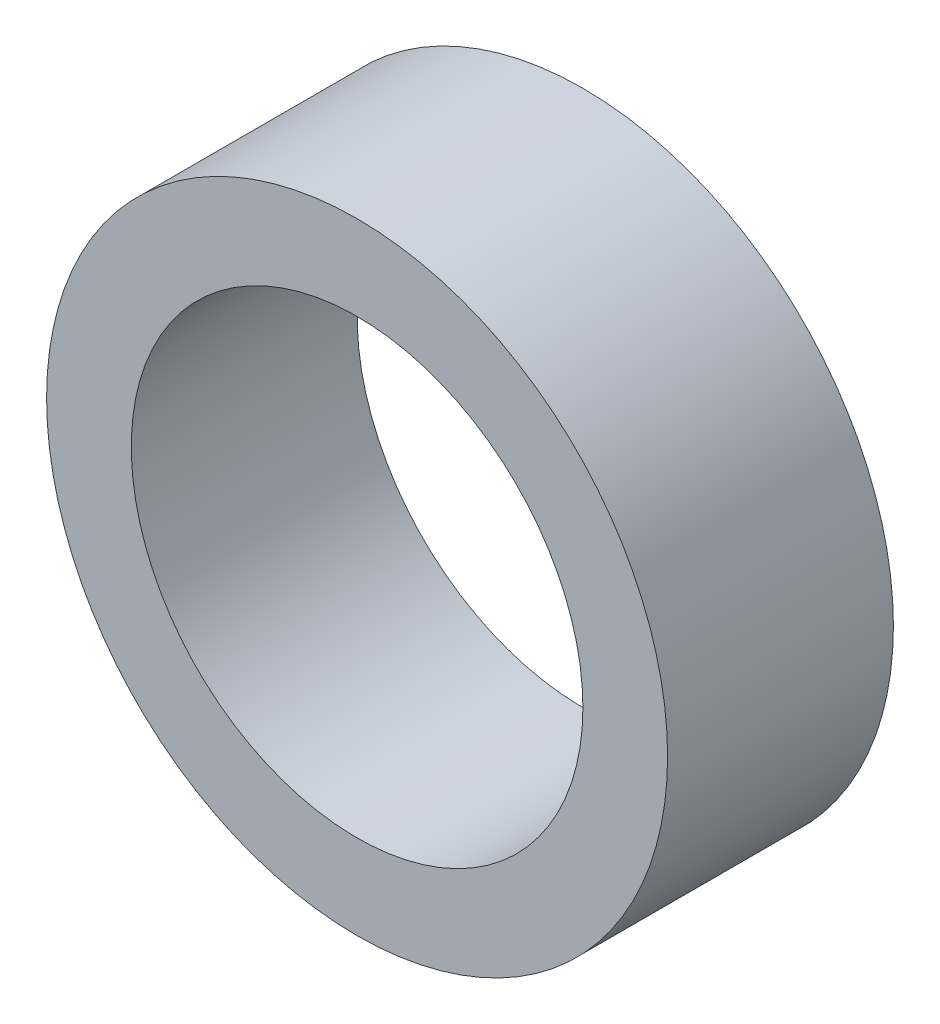
from build123d import *

# Parameters (mm, degrees)
SKETCH_1_R          = 5.5
EXTRUDE_169_DEPTH   = 4
SKETCH_2_R          = 4
CUT_EXTRUDE_1_DEPTH = 9.746427842


with BuildPart() as part:
    # Эскиз1 → Extrude 169 (new body)
    with BuildSketch(Plane.XY):
        Circle(SKETCH_1_R)
    extrude(amount=EXTRUDE_169_DEPTH)

    # Эскиз2 → Вырез-Вытянуть1 (cut, through all)
    with BuildSketch(Plane.XY.offset(4)):
        Circle(SKETCH_2_R)
    extrude(amount=-CUT_EXTRUDE_1_DEPTH, mode=Mode.SUBTRACT)


solid = part.part
